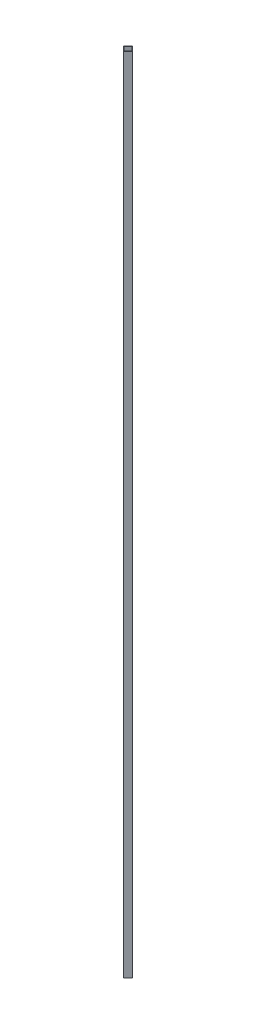
from build123d import *

# Parameters (mm, degrees)
BOSS_EXTRUDE1_DEPTH = 3048


with BuildPart() as part:
    # Sketch1 → Boss-Extrude1 (new body)
    with BuildSketch(Plane(origin=(0, 0, 0), x_dir=(1, 0, 0), z_dir=(0, 1, 0))):
        Polygon((-17.960512242, 0), (0, 17.960512242), (17.960512242, 0), (0, -17.960512242), align=None)
        Polygon((0, -15.697770542), (15.697770542, 0), (0, 15.697770542), (-15.697770542, 0), align=None, mode=Mode.SUBTRACT)
    extrude(amount=BOSS_EXTRUDE1_DEPTH)


solid = part.part
